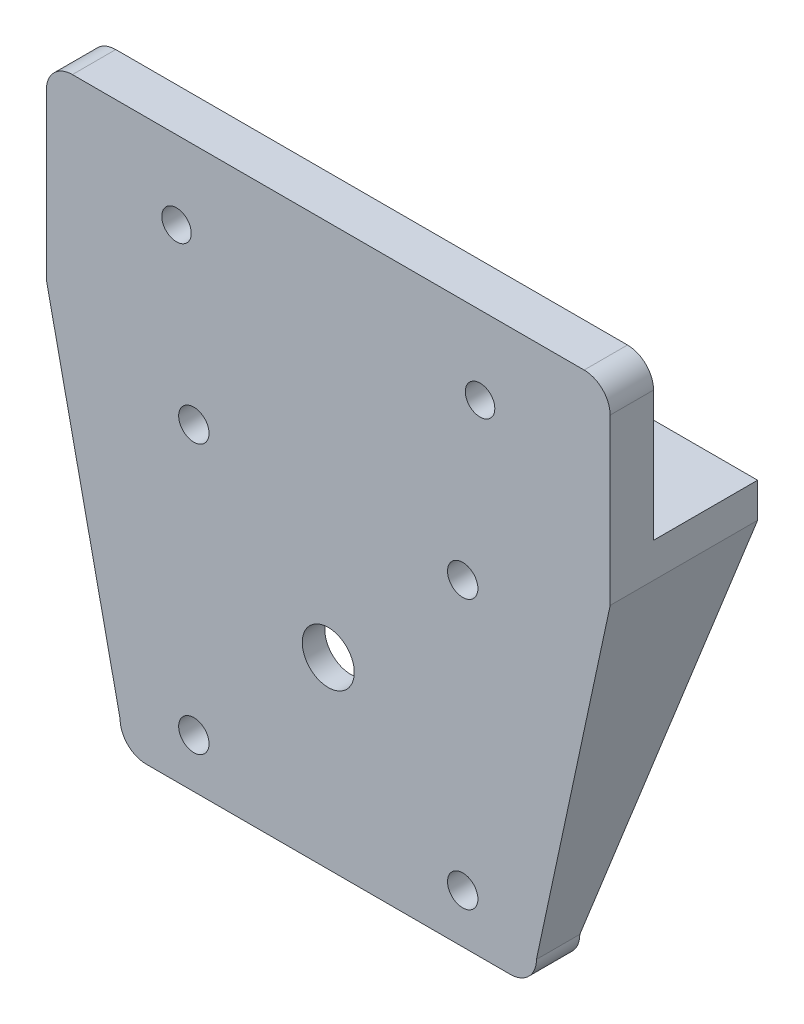
from build123d import *

# Parameters (mm, degrees)
AUFSATZ_LINEAR_AUSTRAGEN1_DEPTH  = 5
SKIZZE2_R                        = 1.75
SKIZZE2_R_2                      = 1.7
SCHNITT_LINEAR_AUSTRAGEN1_DEPTH  = 41.549845869
SKIZZE3_R                        = 11.15
SCHNITT_LINEAR_AUSTRAGEN2_DEPTH  = 2.4
SKIZZE4_R                        = 3
SCHNITT_LINEAR_AUSTRAGEN3_DEPTH  = 41.324310285
SKIZZE9_W                        = 65
SKIZZE9_H                        = 4
AUFSATZ_LINEAR_AUSTRAGEN6_DEPTH  = 12
SKIZZE13_W                       = 8.5
SKIZZE13_H                       = 5
AUFSATZ_LINEAR_AUSTRAGEN8_DEPTH  = 4
AUFSATZ_LINEAR_AUSTRAGEN7_DEPTH  = 2.7
SKIZZE14_R                       = 1.7
SCHNITT_LINEAR_AUSTRAGEN4_DEPTH  = 55.909106713
SKIZZE15_R                       = 3.25
SCHNITT_LINEAR_AUSTRAGEN5_DEPTH  = 3.4
AUFSATZ_LINEAR_AUSTRAGEN9_REACH  = 50.873
AUFSATZ_LINEAR_AUSTRAGEN10_DEPTH = 5
VERRUNDUNG4_R                    = 3
VERRUNDUNG4_OF_SPIEGELN5_R       = 3


with BuildPart() as part:
    # Skizze1 → Aufsatz-Linear austragen1 (new body)
    with BuildSketch(Plane.XY):
        with BuildLine():
            Line((-21, 32.3), (21, 32.3))
            ThreePointArc((21, 32.3), (23.121320344, 31.421320344), (24, 29.3))
            Line((24, 29.3), (24, -29.3))
            ThreePointArc((24, -29.3), (23.121320344, -31.421320344), (21, -32.3))
            Line((21, -32.3), (-21, -32.3))
            ThreePointArc((-21, -32.3), (-23.121320344, -31.421320344), (-24, -29.3))
            Line((-24, -29.3), (-24, 29.3))
            ThreePointArc((-24, 29.3), (-23.121320344, 31.421320344), (-21, 32.3))
        make_face()
    extrude(amount=AUFSATZ_LINEAR_AUSTRAGEN1_DEPTH)

    # Skizze2 → Schnitt-Linear austragen1 (cut, through all)
    with BuildSketch(Plane.XY.offset(5)):
        with Locations((-15.5, -26.65)):
            Circle(SKIZZE2_R)
        with Locations((15.5, -26.65)):
            Circle(SKIZZE2_R)
        with Locations((15.5, 4.35)):
            Circle(SKIZZE2_R)
        with Locations((-15.5, 4.35)):
            Circle(SKIZZE2_R)
        with Locations((-17.5, 23.3)):
            Circle(SKIZZE2_R_2)
        with Locations((17.5, 23.3)):
            Circle(SKIZZE2_R_2)
    extrude(amount=-SCHNITT_LINEAR_AUSTRAGEN1_DEPTH, mode=Mode.SUBTRACT)

    # Skizze3 → Schnitt-Linear austragen2 (cut)
    with BuildSketch(Plane(origin=(0, 0, 0), x_dir=(-1, 0, 0), z_dir=(0, 0, -1))):
        with Locations((0, -11.15)):
            Circle(SKIZZE3_R)
    extrude(amount=-SCHNITT_LINEAR_AUSTRAGEN2_DEPTH, mode=Mode.SUBTRACT)

    # Skizze4 → Schnitt-Linear austragen3 (cut, through all)
    with BuildSketch(Plane(origin=(0, 0, 2.4), x_dir=(-1, 0, 0), z_dir=(0, 0, -1))):
        with Locations((0, -11.15)):
            Circle(SKIZZE4_R)
    extrude(amount=-SCHNITT_LINEAR_AUSTRAGEN3_DEPTH, mode=Mode.SUBTRACT)

    # Skizze9 → Aufsatz-Linear austragen6 (add)
    with BuildSketch(Plane(origin=(0, 0, 0), x_dir=(-1, 0, 0), z_dir=(0, 0, -1))):
        with Locations((0, 12.3)):
            Rectangle(SKIZZE9_W, SKIZZE9_H)
    extrude(amount=AUFSATZ_LINEAR_AUSTRAGEN6_DEPTH)

    # Skizze13 → Aufsatz-Linear austragen8 (add)
    with BuildSketch(Plane(origin=(0, 14.3, 0), x_dir=(1, 0, 0), z_dir=(0, 1, 0))):
        with Locations((28.25, -2.5)):
            Rectangle(SKIZZE13_W, SKIZZE13_H)
    aufsatz_linear_austragen8 = extrude(amount=-AUFSATZ_LINEAR_AUSTRAGEN8_DEPTH)

    # Skizze11 → Aufsatz-Linear austragen7 (add)
    with BuildSketch(Plane(origin=(24, 0, 0), x_dir=(0, 0, -1), z_dir=(1, 0, 0))):
        Polygon((12, 10.3), (0, -29.3), (0, 10.3), align=None)
    aufsatz_linear_austragen7 = extrude(amount=-AUFSATZ_LINEAR_AUSTRAGEN7_DEPTH)

    # Spiegeln4: Aufsatz-Linear austragen8, Aufsatz-Linear austragen7 across plane
    add(aufsatz_linear_austragen8.mirror(Plane.ZY))
    add(aufsatz_linear_austragen7.mirror(Plane.ZY))

    # Skizze14 → Schnitt-Linear austragen4 (cut, through all)
    with BuildSketch(Plane.XZ.offset(-10.3)):
        with Locations(Location((12.5, -6, 0), (0, 0, 270))):
            Circle(SKIZZE14_R)
        with Locations(Location((-12.5, -6, 0), (0, 0, 270))):
            Circle(SKIZZE14_R)
    extrude(amount=-SCHNITT_LINEAR_AUSTRAGEN4_DEPTH, mode=Mode.SUBTRACT)

    # Skizze15 → Schnitt-Linear austragen5 (cut)
    with BuildSketch(Plane(origin=(0, 10.3, 0), x_dir=(-1, 0, 0), z_dir=(0, -1, 0))):
        with Locations(Location((12.5, 6, 0), (0, 0, 90))):
            Circle(SKIZZE15_R)
        with Locations(Location((-12.5, 6, 0), (0, 0, 90))):
            Circle(SKIZZE15_R)
    extrude(amount=-SCHNITT_LINEAR_AUSTRAGEN5_DEPTH, mode=Mode.SUBTRACT)

    # Aufsatz-Linear austragen9: up to this plane
    aufsatz_linear_austragen9_end = Plane(origin=(21.3, 10.3, -12), z_dir=(0, -0.29000739528287084, -0.9570244044334736))
    # Skizze16 → Aufsatz-Linear austragen9 (add, up to the surface)
    with BuildSketch(Plane.XY.offset(5), mode=Mode.PRIVATE) as aufsatz_linear_austragen9_sk1:
        Polygon((32.5, 10.3), (24, -29.3), (24, 10.3), align=None)
    aufsatz_linear_austragen9_tool1 = split(extrude(aufsatz_linear_austragen9_sk1.sketch, amount=-AUFSATZ_LINEAR_AUSTRAGEN9_REACH, mode=Mode.PRIVATE), bisect_by=aufsatz_linear_austragen9_end, keep=Keep.BOTH, mode=Mode.PRIVATE)
    aufsatz_linear_austragen9 = aufsatz_linear_austragen9_tool1.solids().sort_by_distance((26.833333, -2.9, 5))[0]
    add(aufsatz_linear_austragen9)

    # Skizze17 → Aufsatz-Linear austragen10 (add)
    with BuildSketch(Plane.XY.offset(5)):
        Polygon((21, 32.3), (32.5, 32.3), (32.5, 14.3), (24, 14.3), align=None)
    aufsatz_linear_austragen10 = extrude(amount=-AUFSATZ_LINEAR_AUSTRAGEN10_DEPTH)

    # Verrundung4
    verrundung4_edges = [part.edges().sort_by_distance(p)[0] for p in [
        (32.5, 32.3, 2.5),
    ]]
    fillet(verrundung4_edges, radius=VERRUNDUNG4_R)

    # Spiegeln5: Aufsatz-Linear austragen9, Aufsatz-Linear austragen10 across plane
    add(aufsatz_linear_austragen9.mirror(Plane.ZY))
    add(aufsatz_linear_austragen10.mirror(Plane.ZY))

    # Verrundung4 of Spiegeln5
    verrundung4_of_spiegeln5_edges = [part.edges().sort_by_distance(p)[0] for p in [
        (-32.5, 32.3, 2.5),
    ]]
    fillet(verrundung4_of_spiegeln5_edges, radius=VERRUNDUNG4_OF_SPIEGELN5_R)


solid = part.part
